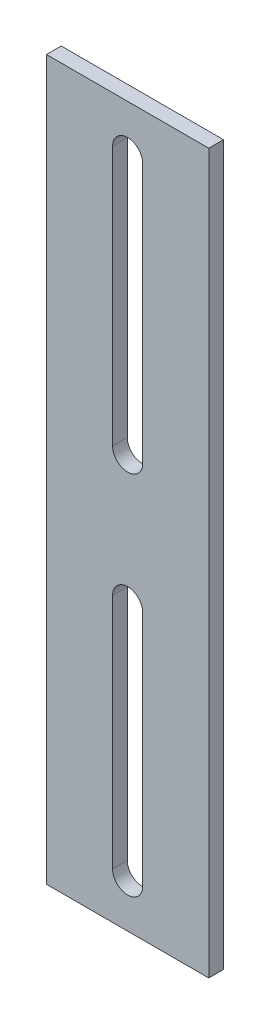
from build123d import *

# Parameters (mm, degrees)
CROQUIS1_W              = 70
CROQUIS1_H              = 310
SALIENTE_EXTRUIR1_DEPTH = 6.35


with BuildPart() as part:
    # Croquis1 → Saliente-Extruir1 (new body)
    with BuildSketch(Plane.XY):
        Rectangle(CROQUIS1_W, CROQUIS1_H)
        with BuildLine():
            Line((6.5, 135), (6.5, 22.99708256))
            ThreePointArc((6.5, 22.99708256), (0, 16.49708256), (-6.5, 22.99708256))
            Line((-6.5, 22.99708256), (-6.5, 135))
            ThreePointArc((-6.5, 135), (0, 141.5), (6.5, 135))
        make_face(mode=Mode.SUBTRACT)
        with BuildLine():
            Line((-6.5, -135), (-6.5, -32.801268397))
            ThreePointArc((-6.5, -32.801268397), (0, -26.301268397), (6.5, -32.801268397))
            Line((6.5, -32.801268397), (6.5, -135))
            ThreePointArc((6.5, -135), (0, -141.5), (-6.5, -135))
        make_face(mode=Mode.SUBTRACT)
    extrude(amount=SALIENTE_EXTRUIR1_DEPTH)


solid = part.part
